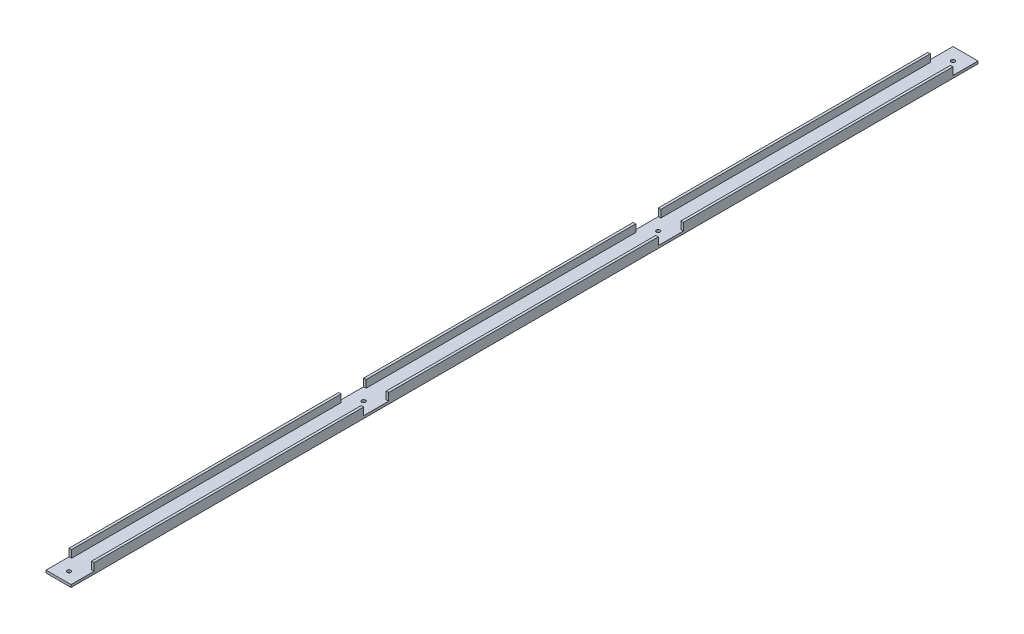
from build123d import *

# Parameters (mm, degrees)
BOSS_EXTRUDE1_DEPTH = 1149.35
SKETCH2_W           = 132.323055729
SKETCH2_H           = 87.040299976
CUT_EXTRUDE1_DEPTH  = 9.525
SKETCH3_W           = 31.75
SKETCH3_H           = 12.7
CUT_EXTRUDE2_DEPTH  = 1150.858589132
SKETCH4_W           = 31.75
SKETCH4_H           = 12.7
CUT_EXTRUDE3_DEPTH  = 1150.858589132
SKETCH5_W           = 31.75
SKETCH5_H           = 12.7
CUT_EXTRUDE4_DEPTH  = 1150.858589132
CUT_EXTRUDE5_REACH  = 1151.828
SKETCH6_R           = 2.413


with BuildPart() as part:
    # Sketch1 → Boss-Extrude1 (new body)
    with BuildSketch(Plane.XY):
        Polygon((3.175, 3.175), (3.175, 12.7), (0, 12.7), (0, 0), (31.75, 0), (31.75, 12.7), (28.575, 12.7), (28.575, 3.175), align=None)
    extrude(amount=BOSS_EXTRUDE1_DEPTH)

    # Sketch2 → Cut-Extrude1 (cut)
    with BuildSketch(Plane(origin=(0, 3.175, 0), x_dir=(1, 0, 0), z_dir=(0, 1, 0))):
        with Locations((4.885698681, 11.770149988)):
            Rectangle(SKETCH2_W, SKETCH2_H)
    extrude(amount=CUT_EXTRUDE1_DEPTH, mode=Mode.SUBTRACT)

    # Sketch3 → Cut-Extrude2 (cut, through all)
    with BuildSketch(Plane.ZY):
        with Locations((389.255, 9.525)):
            Rectangle(SKETCH3_W, SKETCH3_H)
    extrude(amount=-CUT_EXTRUDE2_DEPTH, mode=Mode.SUBTRACT)

    # Sketch4 → Cut-Extrude3 (cut, through all)
    with BuildSketch(Plane.ZY):
        with Locations((762.635, 9.525)):
            Rectangle(SKETCH4_W, SKETCH4_H)
    extrude(amount=-CUT_EXTRUDE3_DEPTH, mode=Mode.SUBTRACT)

    # Sketch5 → Cut-Extrude4 (cut, through all)
    with BuildSketch(Plane.ZY):
        with Locations((1136.015, 9.525)):
            Rectangle(SKETCH5_W, SKETCH5_H)
    extrude(amount=-CUT_EXTRUDE4_DEPTH, mode=Mode.SUBTRACT)

    # Sketch6 → Cut-Extrude5 (cut, up to next)
    with BuildSketch(Plane(origin=(0, 3.175, 0), x_dir=(1, 0, 0), z_dir=(0, 1, 0)), mode=Mode.PRIVATE) as cut_extrude5_sk1:
        with Locations(Location((15.875, -15.875, 0), (0, 0, 270))):
            Circle(SKETCH6_R)
    cut_extrude5_tool1 = extrude(cut_extrude5_sk1.sketch, amount=-CUT_EXTRUDE5_REACH, mode=Mode.PRIVATE) & part.part
    # Sketch6 → Cut-Extrude5 (cut, up to next)
    with BuildSketch(Plane(origin=(0, 3.175, 0), x_dir=(1, 0, 0), z_dir=(0, 1, 0)), mode=Mode.PRIVATE) as cut_extrude5_sk2:
        with Locations(Location((15.875, -389.255, 0), (0, 0, 270))):
            Circle(SKETCH6_R)
    cut_extrude5_tool2 = extrude(cut_extrude5_sk2.sketch, amount=-CUT_EXTRUDE5_REACH, mode=Mode.PRIVATE) & part.part
    # Sketch6 → Cut-Extrude5 (cut, up to next)
    with BuildSketch(Plane(origin=(0, 3.175, 0), x_dir=(1, 0, 0), z_dir=(0, 1, 0)), mode=Mode.PRIVATE) as cut_extrude5_sk3:
        with Locations(Location((15.875, -762.635, 0), (0, 0, 270))):
            Circle(SKETCH6_R)
    cut_extrude5_tool3 = extrude(cut_extrude5_sk3.sketch, amount=-CUT_EXTRUDE5_REACH, mode=Mode.PRIVATE) & part.part
    # Sketch6 → Cut-Extrude5 (cut, up to next)
    with BuildSketch(Plane(origin=(0, 3.175, 0), x_dir=(1, 0, 0), z_dir=(0, 1, 0)), mode=Mode.PRIVATE) as cut_extrude5_sk4:
        with Locations(Location((15.875, -1136.015, 0), (0, 0, 270))):
            Circle(SKETCH6_R)
    cut_extrude5_tool4 = extrude(cut_extrude5_sk4.sketch, amount=-CUT_EXTRUDE5_REACH, mode=Mode.PRIVATE) & part.part
    add(cut_extrude5_tool1.solids().sort_by_distance((15.875, 3.175, 15.875))[0], mode=Mode.SUBTRACT)
    add(cut_extrude5_tool2.solids().sort_by_distance((15.875, 3.175, 389.255))[0], mode=Mode.SUBTRACT)
    add(cut_extrude5_tool3.solids().sort_by_distance((15.875, 3.175, 762.635))[0], mode=Mode.SUBTRACT)
    add(cut_extrude5_tool4.solids().sort_by_distance((15.875, 3.175, 1136.015))[0], mode=Mode.SUBTRACT)


solid = part.part
